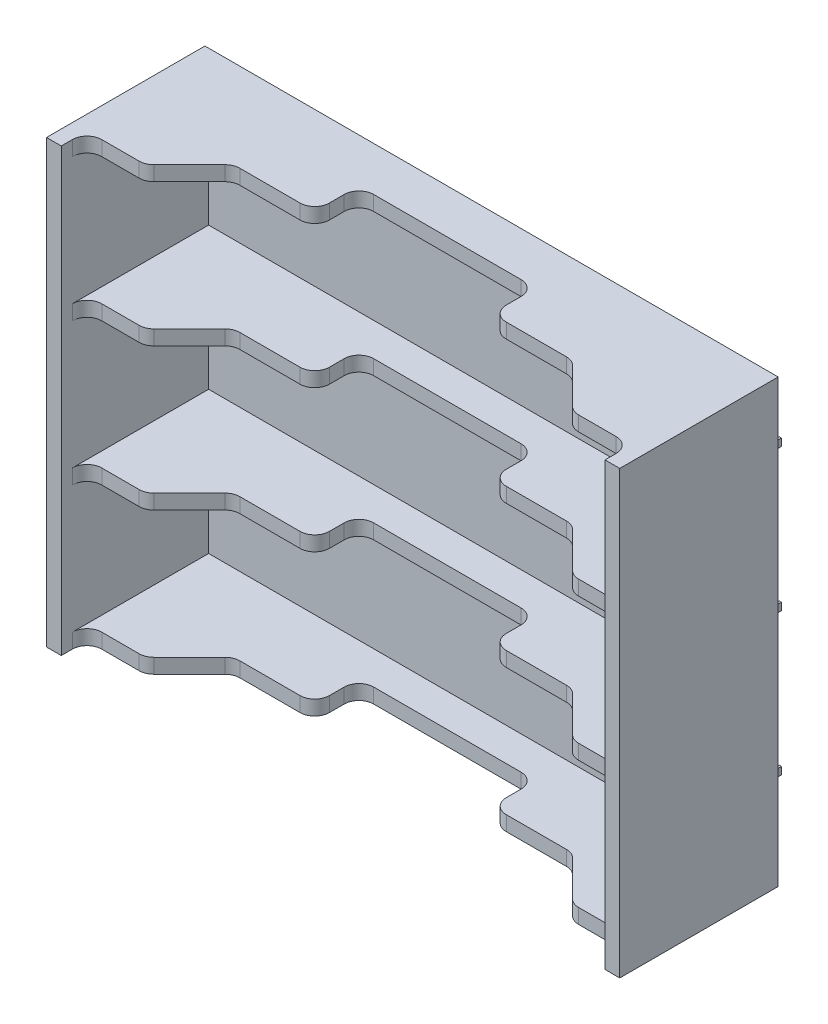
from build123d import *

# Parameters (mm, degrees)
SKETCH1_W           = 77.8
SKETCH1_H           = 59.9
BOSS_EXTRUDE1_DEPTH = 21.5
CUT_EXTRUDE1_DEPTH  = 75.588672062
FILLET1_R           = 2
SKETCH4_W           = 73.8
SKETCH4_H           = 17.3
CUT_EXTRUDE2_DEPTH  = 20
SKETCH5_R           = 1.75
CUT_EXTRUDE3_DEPTH  = 54.011437445
SKETCH6_W           = 0.3
SKETCH6_H           = 1
BOSS_EXTRUDE2_DEPTH = 3.2


with BuildPart() as part:
    # Sketch1 → Boss-Extrude1 (new body)
    with BuildSketch(Plane.XY):
        Rectangle(SKETCH1_W, SKETCH1_H)
    extrude(amount=BOSS_EXTRUDE1_DEPTH)

    # Sketch2 → Cut-Extrude1 (cut, through all)
    with BuildSketch(Plane.XZ.offset(29.95)):
        Polygon((-36.9, 21.5), (36.9, 21.5), (36.9, 18), (29, 18), (23, 12), (12, 12), (12, 6), (-12, 6), (-12, 12), (-23, 12), (-29, 18), (-36.9, 18), align=None)
    extrude(amount=-CUT_EXTRUDE1_DEPTH, mode=Mode.SUBTRACT)

    # Fillet1
    fillet1_edges = [part.edges().sort_by_distance(p)[0] for p in [
        (-12, 0, 12),
        (-23, 0, 12),
        (-29, 0, 18),
        (-36.9, 0, 18),
        (36.9, 0, 18),
        (29, 0, 18),
        (23, 0, 12),
        (12, 0, 12),
        (12, 0, 6),
        (-12, 0, 6),
    ]]
    fillet(fillet1_edges, radius=FILLET1_R)

    # Sketch4 → Cut-Extrude2 (cut)
    with BuildSketch(Plane.XY.offset(21.5)):
        with Locations((0, 19.3)):
            Rectangle(SKETCH4_W, SKETCH4_H)
        Rectangle(SKETCH4_W, SKETCH4_H)
        with Locations((0, -19.3)):
            Rectangle(SKETCH4_W, SKETCH4_H)
    extrude(amount=-CUT_EXTRUDE2_DEPTH, mode=Mode.SUBTRACT)

    # Sketch5 → Cut-Extrude3 (cut, through all)
    with BuildSketch(Plane.XY.offset(1.5)):
        with Locations((-27.9, 0)):
            Circle(SKETCH5_R)
        with Locations((-27.9, 19.3)):
            Circle(SKETCH5_R)
        with Locations(Location((27.9, 0, 0), (0, 0, 180))):
            Circle(SKETCH5_R)
        with Locations(Location((27.9, 19.3, 0), (0, 0, 180))):
            Circle(SKETCH5_R)
        with Locations((27.9, -19.3)):
            Circle(SKETCH5_R)
        with Locations(Location((-27.9, -19.3, 0), (0, 0, 180))):
            Circle(SKETCH5_R)
    extrude(amount=-CUT_EXTRUDE3_DEPTH, mode=Mode.SUBTRACT)

    # Sketch6 → Boss-Extrude2 (add)
    with BuildSketch(Plane(origin=(0, 0, 0), x_dir=(-1, 0, 0), z_dir=(0, 0, -1))):
        with Locations((-36, 0)):
            Rectangle(SKETCH6_W, SKETCH6_H)
        with Locations((-36, 19.3)):
            Rectangle(SKETCH6_W, SKETCH6_H)
        with Locations((36, 19.3)):
            Rectangle(SKETCH6_W, SKETCH6_H)
        with Locations((36, 0)):
            Rectangle(SKETCH6_W, SKETCH6_H)
        with Locations((36, -19.3)):
            Rectangle(SKETCH6_W, SKETCH6_H)
        with Locations((-36, -19.3)):
            Rectangle(SKETCH6_W, SKETCH6_H)
    extrude(amount=BOSS_EXTRUDE2_DEPTH)


solid = part.part
